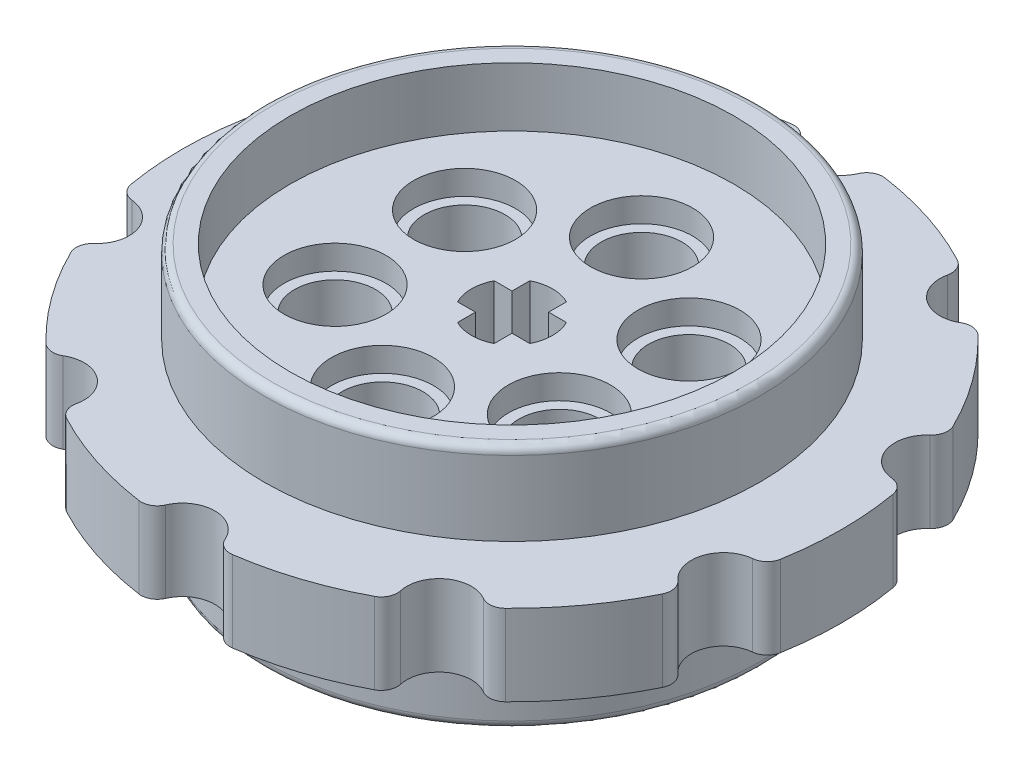
from build123d import *

# Parameters (mm, degrees)
SKETCH_1_R                       = 15.3
SKETCH_1_R_2                     = 13.7
EXTRUDE_1_DEPTH                  = 7.6
SKETCH_1_3_R                     = 20.35
EXTRUDE_2_DEPTH                  = 2.5
SKETCH_1_7_R                     = 13.7
EXTRUDE_3_DEPTH                  = 3.95
SKETCH_1_4_R                     = 2
CUT_EXTRUDE_1_DEPTH              = 30.765836121
FILLET_1_R                       = 1
PATTERN_CIRCULAR_1_COUNT         = 10
FILLET_1_OF_PATTERN_CIRCULAR_1_R = 1
FILLET_2_R                       = 0.5
CUT_EXTRUDE_2_DEPTH              = 31.369287842
CUT_EXTRUDE_2_DEPTH_BACK         = 31.369287842
SKETCH_3_R                       = 2.5
CUT_EXTRUDE_3_DEPTH              = 31.369287842
CUT_EXTRUDE_START                = 1.45
SKETCH_3_3_R                     = 3.15
CUT_EXTRUDE_4_DEPTH              = 1.5
CUT_EXTRUDE_START_2              = -4.95
SKETCH_3_4_R                     = 3.15
CUT_EXTRUDE_5_DEPTH              = 1.5
PATTERN_CIRCULAR_2_COUNT         = 6


with BuildPart() as part:
    # 草图1 → 凸台-拉伸1 (new, symmetric)
    with BuildSketch(Plane(origin=(0, 0, 0), x_dir=(1, 0, 0), z_dir=(0, 1, 0))):
        with Locations(Location((0, 0, 0), (0, 0, 90))):
            Circle(SKETCH_1_R)
        with Locations(Location((0, 0, 0), (0, 0, 90))):
            Circle(SKETCH_1_R_2, mode=Mode.SUBTRACT)
    extrude(amount=EXTRUDE_1_DEPTH, both=True)

    # 草图1<3> → 凸台-拉伸2 (add, symmetric)
    with BuildSketch(Plane(origin=(0, 0, 0), x_dir=(1, 0, 0), z_dir=(0, 1, 0))):
        with Locations(Location((0, 0, 0), (0, 0, 270))):
            Circle(SKETCH_1_3_R)
    extrude(amount=EXTRUDE_2_DEPTH, both=True)

    # 草图1<7> → 凸台-拉伸3 (add, symmetric)
    with BuildSketch(Plane(origin=(0, 0, 0), x_dir=(1, 0, 0), z_dir=(0, 1, 0))):
        with Locations(Location((0, 0, 0), (0, 0, 90))):
            Circle(SKETCH_1_7_R)
    extrude(amount=EXTRUDE_3_DEPTH, both=True)

    # 草图1<4> → 切除-拉伸1 (cut, symmetric)
    with BuildSketch(Plane(origin=(0, 0, 0), x_dir=(1, 0, 0), z_dir=(0, 1, 0))):
        with Locations((0, 20.35)):
            Circle(SKETCH_1_4_R)
    cut_extrude_1 = extrude(amount=CUT_EXTRUDE_1_DEPTH, both=True, mode=Mode.SUBTRACT)

    # 圆角1
    fillet_1_edges = [part.edges().sort_by_distance(p)[0] for p in [
        (-1.997583796, 0, -20.251719902),
        (1.997583796, 0, -20.251719902),
    ]]
    fillet(fillet_1_edges, radius=FILLET_1_R)

    # 阵列(圆周)1: 切除-拉伸1 ×10 about axis
    pattern_circular_1_axis = Axis((0, 0, 0), (0, 1, 0))
    for i in range(1, PATTERN_CIRCULAR_1_COUNT):
        add(cut_extrude_1.rotate(pattern_circular_1_axis, i * 360 / PATTERN_CIRCULAR_1_COUNT), mode=Mode.SUBTRACT)

    # 圆角1 of 阵列(圆周)1
    fillet_1_of_pattern_circular_1_edges = [part.edges().sort_by_distance(p)[0] for p in [
        (-13.51974153, 0, -15.20983527),
        (-10.287583053, 0, -17.558135861),
        (-19.877817519, 0, -4.358310529),
        (-18.643242838, 0, -8.157940701),
        (-18.643242838, 0, 8.157940701),
        (-19.877817519, 0, 4.358310529),
        (-10.287583053, 0, 17.558135861),
        (-13.51974153, 0, 15.20983527),
        (1.997583796, 0, 20.251719902),
        (-1.997583796, 0, 20.251719902),
        (13.51974153, 0, 15.20983527),
        (10.287583053, 0, 17.558135861),
        (19.877817519, 0, 4.358310529),
        (18.643242838, 0, 8.157940701),
        (18.643242838, 0, -8.157940701),
        (19.877817519, 0, -4.358310529),
        (10.287583053, 0, -17.558135861),
        (13.51974153, 0, -15.20983527),
    ]]
    fillet(fillet_1_of_pattern_circular_1_edges, radius=FILLET_1_OF_PATTERN_CIRCULAR_1_R)

    # 圆角2
    fillet_2_edges = [part.edges().sort_by_distance(p)[0] for p in [
        (0, -7.6, 15.3),
        (0, 7.6, 15.3),
    ]]
    fillet(fillet_2_edges, radius=FILLET_2_R)

    # 草图2 → 切除-拉伸2 (cut, two sides: drawn at the far end of the back side and taken through both)
    with BuildSketch(Plane(origin=(0, 2.5, 0), x_dir=(1, 0, 0), z_dir=(0, 1, 0)).offset(-CUT_EXTRUDE_2_DEPTH_BACK)):
        with BuildLine():
            Line((-1.130029762, -1.130029762), (-1.130029762, -2.230029762))
            ThreePointArc((-1.130029762, -2.230029762), (0, -2.5), (1.130029762, -2.230029762))
            Line((1.130029762, -2.230029762), (1.130029762, -1.130029762))
            Line((1.130029762, -1.130029762), (2.230029762, -1.130029762))
            ThreePointArc((2.230029762, -1.130029762), (2.5, 0), (2.230029762, 1.130029762))
            Line((2.230029762, 1.130029762), (1.130029762, 1.130029762))
            Line((1.130029762, 1.130029762), (1.130029762, 2.230029762))
            ThreePointArc((1.130029762, 2.230029762), (0, 2.5), (-1.130029762, 2.230029762))
            Line((-1.130029762, 2.230029762), (-1.130029762, 1.130029762))
            Line((-1.130029762, 1.130029762), (-2.230029762, 1.130029762))
            ThreePointArc((-2.230029762, 1.130029762), (-2.5, 0), (-2.230029762, -1.130029762))
            Line((-2.230029762, -1.130029762), (-1.130029762, -1.130029762))
        make_face()
    extrude(amount=CUT_EXTRUDE_2_DEPTH + CUT_EXTRUDE_2_DEPTH_BACK, mode=Mode.SUBTRACT)

    # 草图3 → 切除-拉伸3 (cut, symmetric)
    with BuildSketch(Plane(origin=(0, 2.5, 0), x_dir=(1, 0, 0), z_dir=(0, 1, 0))):
        with Locations(Location((0, 8, 0), (0, 0, 270))):
            Circle(SKETCH_3_R)
    cut_extrude_3 = extrude(amount=CUT_EXTRUDE_3_DEPTH, both=True, mode=Mode.SUBTRACT)

    # 草图3<3> → 切除-拉伸4 (cut)
    with BuildSketch(Plane(origin=(0, 2.5, 0), x_dir=(1, 0, 0), z_dir=(0, 1, 0)).offset(CUT_EXTRUDE_START)):
        with Locations(Location((0, 8, 0), (0, 0, 270))):
            Circle(SKETCH_3_3_R)
    cut_extrude_4 = extrude(amount=-CUT_EXTRUDE_4_DEPTH, mode=Mode.SUBTRACT)

    # 草图3<4> → 切除-拉伸5 (cut)
    with BuildSketch(Plane(origin=(0, 2.5, 0), x_dir=(1, 0, 0), z_dir=(0, 1, 0)).offset(CUT_EXTRUDE_START_2)):
        with Locations(Location((0, 8, 0), (0, 0, 270))):
            Circle(SKETCH_3_4_R)
    cut_extrude_5 = extrude(amount=-CUT_EXTRUDE_5_DEPTH, mode=Mode.SUBTRACT)

    # 阵列(圆周)2: 切除-拉伸3, 切除-拉伸4, 切除-拉伸5 ×6 about axis
    pattern_circular_2_axis = Axis((0, 0, 0), (0, 1, 0))
    add([cut_extrude_3.rotate(pattern_circular_2_axis, i * 360 / PATTERN_CIRCULAR_2_COUNT) for i in range(1, PATTERN_CIRCULAR_2_COUNT)], mode=Mode.SUBTRACT)
    add([cut_extrude_4.rotate(pattern_circular_2_axis, i * 360 / PATTERN_CIRCULAR_2_COUNT) for i in range(1, PATTERN_CIRCULAR_2_COUNT)], mode=Mode.SUBTRACT)
    add([cut_extrude_5.rotate(pattern_circular_2_axis, i * 360 / PATTERN_CIRCULAR_2_COUNT) for i in range(1, PATTERN_CIRCULAR_2_COUNT)], mode=Mode.SUBTRACT)


solid = part.part
